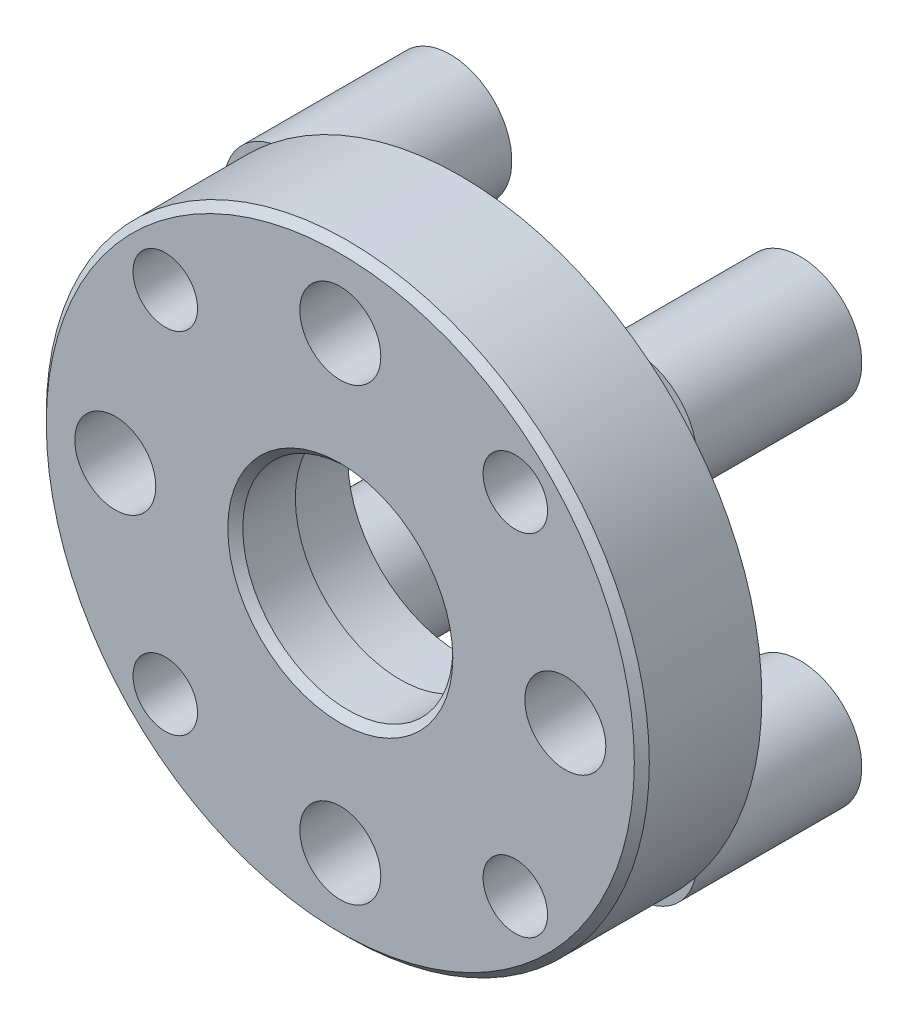
from build123d import *

# Parameters (mm, degrees)
SKETCH3_R             = 4
BOSS_EXTRUDE1_DEPTH   = 11
BOSS_EXTRUDE1_2_DEPTH = 11
BOSS_EXTRUDE1_3_DEPTH = 11
BOSS_EXTRUDE1_4_DEPTH = 11
SKETCH6_R             = 7.5
BOSS_EXTRUDE6_DEPTH   = 8
SKETCH8_R             = 1.6
CUT_EXTRUDE1_DEPTH    = 35.190934471
SKETCH9_R             = 3
CUT_EXTRUDE2_DEPTH    = 3
BOSS_EXTRUDE8_START   = -11
SKETCH10_R            = 4.1
SKETCH10_R_2          = 4
BOSS_EXTRUDE8_DEPTH   = 11
SKETCH11_R            = 2.7
SKETCH11_R_2          = 2.15
CUT_EXTRUDE3_DEPTH    = 8
BOSS_EXTRUDE9_START   = -4
SKETCH12_R            = 7.5
SKETCH12_R_2          = 7
BOSS_EXTRUDE9_DEPTH   = 4
CHAMFER1_SIZE         = 0.5


with BuildPart() as part:
    # Sketch3 → Boss-Extrude1 (new body)
    with BuildSketch(Plane(origin=(0, 0, 25.23473679), x_dir=(-1, 0, 0), z_dir=(0, 0, -1))):
        with Locations((-11.66726189, 11.66726189)):
            Circle(SKETCH3_R)
    extrude(amount=BOSS_EXTRUDE1_DEPTH)



with BuildPart() as body_2:
    # Sketch3 → Boss-Extrude1 2 (new body)
    with BuildSketch(Plane(origin=(0, 0, 25.23473679), x_dir=(-1, 0, 0), z_dir=(0, 0, -1))):
        with Locations((11.66726189, 11.66726189)):
            Circle(SKETCH3_R)
    extrude(amount=BOSS_EXTRUDE1_2_DEPTH)


with BuildPart() as body_3:
    # Sketch3 → Boss-Extrude1 3 (new body)
    with BuildSketch(Plane(origin=(0, 0, 25.23473679), x_dir=(-1, 0, 0), z_dir=(0, 0, -1))):
        with Locations((11.66726189, -11.66726189)):
            Circle(SKETCH3_R)
    extrude(amount=BOSS_EXTRUDE1_3_DEPTH)


with BuildPart() as body_4:
    # Sketch3 → Boss-Extrude1 4 (new body)
    with BuildSketch(Plane(origin=(0, 0, 25.23473679), x_dir=(-1, 0, 0), z_dir=(0, 0, -1))):
        with Locations((-11.66726189, -11.66726189)):
            Circle(SKETCH3_R)
    extrude(amount=BOSS_EXTRUDE1_4_DEPTH)


with BuildPart() as part_1:
    add(part.part)

    add(body_2.part)  # Boss-Extrude6 merges body 2

    add(body_3.part)  # Boss-Extrude6 merges body 3

    add(body_4.part)  # Boss-Extrude6 merges body 4
    # Sketch6 → Boss-Extrude6 (add)
    with BuildSketch(Plane.XY.offset(25.23473679)):
        with BuildLine():
            ThreePointArc((16.992766074, -10.735730117), (19.607007689, 4.424392555), (10.735730117, 16.992766074))
            ThreePointArc((10.735730117, 16.992766074), (-4.424392555, 19.607007689), (-16.992766074, 10.735730117))
            ThreePointArc((-16.992766074, 10.735730117), (-19.607007689, -4.424392555), (-10.735730117, -16.992766074))
            ThreePointArc((-10.735730117, -16.992766074), (4.424392555, -19.607007689), (16.992766074, -10.735730117))
        make_face()
        Circle(SKETCH6_R, mode=Mode.SUBTRACT)
    extrude(amount=BOSS_EXTRUDE6_DEPTH)

    # Sketch8 → Cut-Extrude1 (cut, through all)
    with BuildSketch(Plane.XY.offset(33.23473679)):
        with Locations((11.66726189, 11.66726189)):
            Circle(SKETCH8_R)
        with Locations((11.66726189, -11.66726189)):
            Circle(SKETCH8_R)
        with Locations((-11.66726189, -11.66726189)):
            Circle(SKETCH8_R)
        with Locations((-11.66726189, 11.66726189)):
            Circle(SKETCH8_R)
    extrude(amount=-CUT_EXTRUDE1_DEPTH, mode=Mode.SUBTRACT)

    # Sketch9 → Cut-Extrude2 (cut)
    with BuildSketch(Plane.XY.offset(14.23473679)):
        with Locations(Location((11.66726189, 11.66726189, 0), (0, 0, 180))):
            Circle(SKETCH9_R)
        with Locations(Location((11.66726189, -11.66726189, 0), (0, 0, 180))):
            Circle(SKETCH9_R)
        with Locations(Location((-11.66726189, -11.66726189, 0), (0, 0, 180))):
            Circle(SKETCH9_R)
        with Locations(Location((-11.66726189, 11.66726189, 0), (0, 0, 180))):
            Circle(SKETCH9_R)
    extrude(amount=CUT_EXTRUDE2_DEPTH, mode=Mode.SUBTRACT)

    # Sketch10 → Boss-Extrude8 (add)
    # profile 1 of 4: a face of its own
    with BuildSketch(Plane(origin=(0, 0, 14.23473679), x_dir=(-1, 0, 0), z_dir=(0, 0, -1)).offset(BOSS_EXTRUDE8_START)):
        with Locations((11.66726189, 11.66726189)):
            Circle(SKETCH10_R)
        with Locations((11.66726189, 11.66726189)):
            Circle(SKETCH10_R_2, mode=Mode.SUBTRACT)
    # profile 2 of 4: a face of its own
    with BuildSketch(Plane(origin=(0, 0, 14.23473679), x_dir=(-1, 0, 0), z_dir=(0, 0, -1)).offset(BOSS_EXTRUDE8_START)):
        with Locations((11.66726189, -11.66726189)):
            Circle(SKETCH10_R)
        with Locations((11.66726189, -11.66726189)):
            Circle(SKETCH10_R_2, mode=Mode.SUBTRACT)
    # profile 3 of 4: a face of its own
    with BuildSketch(Plane(origin=(0, 0, 14.23473679), x_dir=(-1, 0, 0), z_dir=(0, 0, -1)).offset(BOSS_EXTRUDE8_START)):
        with Locations((-11.66726189, -11.66726189)):
            Circle(SKETCH10_R)
        with Locations((-11.66726189, -11.66726189)):
            Circle(SKETCH10_R_2, mode=Mode.SUBTRACT)
    # profile 4 of 4: a face of its own
    with BuildSketch(Plane(origin=(0, 0, 14.23473679), x_dir=(-1, 0, 0), z_dir=(0, 0, -1)).offset(BOSS_EXTRUDE8_START)):
        with Locations((-11.66726189, 11.66726189)):
            Circle(SKETCH10_R)
        with Locations((-11.66726189, 11.66726189)):
            Circle(SKETCH10_R_2, mode=Mode.SUBTRACT)
    extrude(amount=BOSS_EXTRUDE8_DEPTH)

    # Sketch11 → Cut-Extrude3 (cut)
    with BuildSketch(Plane.XY.offset(33.23473679)):
        with Locations((0, 15)):
            Circle(SKETCH11_R)
        with Locations((15, 0)):
            Circle(SKETCH11_R)
        with Locations((0, -15)):
            Circle(SKETCH11_R)
        with Locations((-15, 0)):
            Circle(SKETCH11_R)
        with Locations((-11.66726189, 11.66726189)):
            Circle(SKETCH11_R_2)
        with Locations((11.66726189, 11.66726189)):
            Circle(SKETCH11_R_2)
        with Locations((11.66726189, -11.66726189)):
            Circle(SKETCH11_R_2)
        with Locations((-11.66726189, -11.66726189)):
            Circle(SKETCH11_R_2)
    extrude(amount=-CUT_EXTRUDE3_DEPTH, mode=Mode.SUBTRACT)

    # Sketch12 → Boss-Extrude9 (add)
    with BuildSketch(Plane.XY.offset(33.23473679).offset(BOSS_EXTRUDE9_START)):
        Circle(SKETCH12_R)
        Circle(SKETCH12_R_2, mode=Mode.SUBTRACT)
    extrude(amount=BOSS_EXTRUDE9_DEPTH)

    # Chamfer1
    chamfer1_edges = [part_1.edges().sort_by_distance(p)[0] for p in [
        (-10.735730117, -16.992766074, 33.23473679),
        (-7, 0, 33.23473679),
    ]]
    chamfer(chamfer1_edges, length=CHAMFER1_SIZE)


solid = part_1.part
